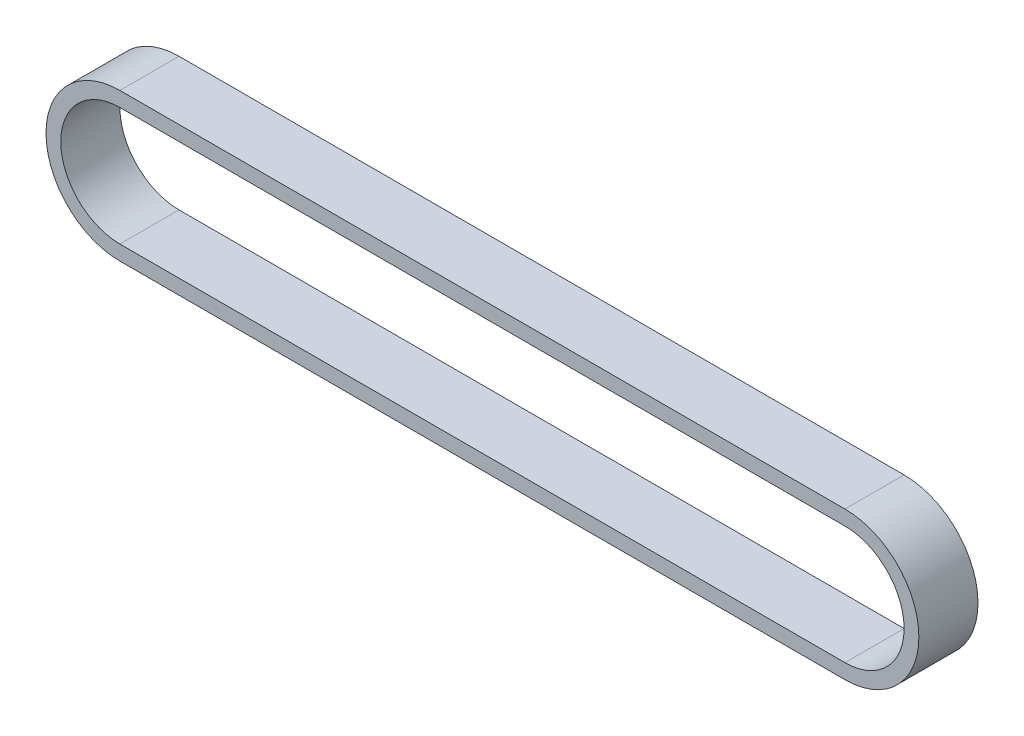
from build123d import *

# Parameters (mm, degrees)
EXTRUDE_THIN1_DEPTH = 3


with BuildPart() as part:
    # Sketch1 → Extrude-Thin1 (new, symmetric)
    with BuildSketch(Plane.XY):
        with BuildLine():
            Line((36.789823876, 1), (-36.789823876, 1))
            ThreePointArc((-36.789823876, 1), (-44.289823876, -6.5), (-36.789823876, -14))
            Line((-36.789823876, -14), (36.789823876, -14))
            ThreePointArc((36.789823876, -14), (44.289823876, -6.5), (36.789823876, 1))
        make_face()
        with BuildLine():
            Line((36.789823876, -0.5), (-36.789823876, -0.5))
            ThreePointArc((-36.789823876, -0.5), (-42.789823876, -6.5), (-36.789823876, -12.5))
            Line((-36.789823876, -12.5), (36.789823876, -12.5))
            ThreePointArc((36.789823876, -12.5), (42.789823876, -6.5), (36.789823876, -0.5))
        make_face(mode=Mode.SUBTRACT)
    extrude(amount=EXTRUDE_THIN1_DEPTH, both=True)


solid = part.part
